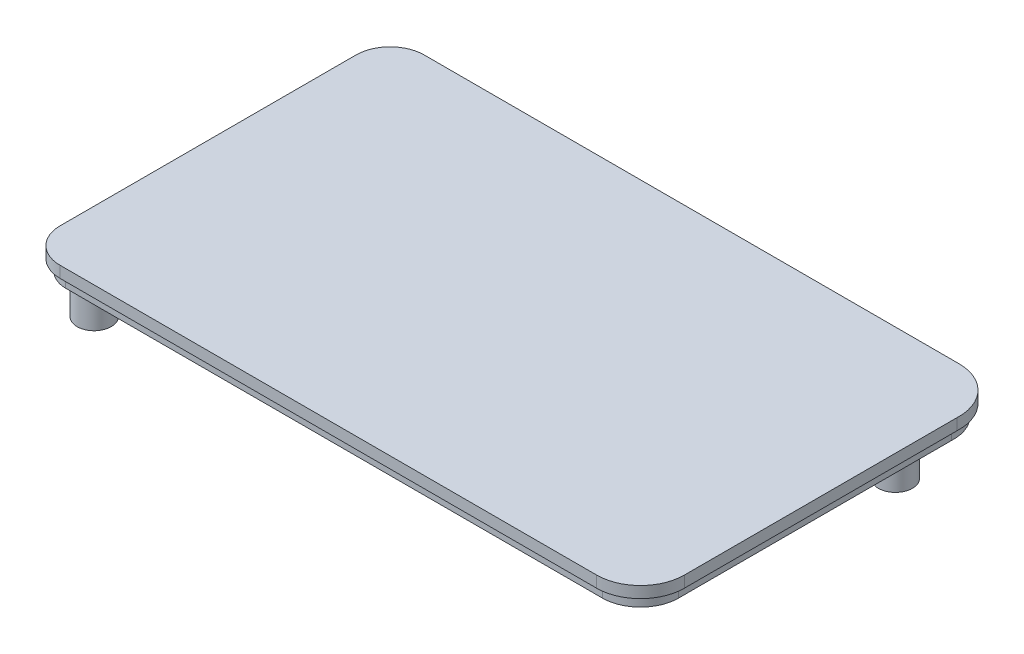
from build123d import *

# Parameters (mm, degrees)
Y_KSEKLIK_EKSTR_ZYON1_DEPTH = 2
KES_EKSTR_ZYON1_DEPTH       = 1
IZIM6_R                     = 1.501031458
IZIM6_R_2                   = 1.001031998
IZIM6_R_3                   = 1.5
IZIM6_R_4                   = 1.00000054
Y_KSEKLIK_EKSTR_ZYON3_DEPTH = 3.425399462


with BuildPart() as part:
    # Çizim1 → Yükseklik-Ekstrüzyon1 (new body)
    with BuildSketch(Plane(origin=(0, 0, 0), x_dir=(1, 0, 0), z_dir=(0, 1, 0))):
        with BuildLine():
            Line((69.354296896, 0), (22.205894341, 0))
            ThreePointArc((22.205894341, 0), (20.084057526, 0.878893586), (19.20516394, 3.000730401))
            Line((19.20516394, 3.000730401), (19.20516394, 28.999269019))
            ThreePointArc((19.20516394, 28.999269019), (20.084057735, 31.121106339), (22.205895054, 32.000000134))
            Line((22.205895054, 32.000000134), (69.204054025, 31.999999983))
            ThreePointArc((69.204054025, 31.999999983), (72.103447224, 30.757719929), (73.203992826, 27.80161776))
            Line((73.203992826, 27.80161776), (73.205163894, 3.84969587))
            ThreePointArc((73.205163894, 3.84969587), (72.076857039, 1.127478795), (69.354296896, 0))
        make_face()
    extrude(amount=Y_KSEKLIK_EKSTR_ZYON1_DEPTH)

    # Çizim2 → Kes-Ekstrüzyon1 (cut)
    with BuildSketch(Plane.XZ):
        with BuildLine():
            Line((22.205894341, 0), (69.354296896, 0))
            ThreePointArc((69.354296896, 0), (72.076886077, -1.127507843), (73.205163905, -3.849778017))
            Line((73.205163905, -3.849778017), (73.204578669, -27.814116173))
            ThreePointArc((73.204578669, -27.814116173), (72.09912832, -30.762246017), (69.204054025, -31.999999983))
            Line((69.204054025, -31.999999983), (22.205895054, -32.000000134))
            ThreePointArc((22.205895054, -32.000000134), (20.084057735, -31.121106339), (19.20516394, -28.999269019))
            Line((19.20516394, -28.999269019), (19.20516394, -3.000730401))
            ThreePointArc((19.20516394, -3.000730401), (20.084057526, -0.878893586), (22.205894341, 0))
        make_face()
        with BuildLine():
            Line((22.205894341, -0.5), (69.354296896, -0.5))
            ThreePointArc((69.354296896, -0.5), (71.723357422, -1.481085951), (72.705163917, -3.849847954))
            Line((72.705163917, -3.849847954), (72.704578383, -27.82580896))
            ThreePointArc((72.704578383, -27.82580896), (71.741441976, -30.412825453), (69.204054025, -31.499999983))
            Line((69.204054025, -31.499999983), (22.205895054, -31.500000134))
            ThreePointArc((22.205895054, -31.500000134), (20.437611125, -30.767552948), (19.70516394, -28.999269019))
            Line((19.70516394, -28.999269019), (19.70516394, -3.000730401))
            ThreePointArc((19.70516394, -3.000730401), (20.437610916, -1.232446977), (22.205894341, -0.5))
        make_face(mode=Mode.SUBTRACT)
    extrude(amount=-KES_EKSTR_ZYON1_DEPTH, mode=Mode.SUBTRACT)

    # Çizim6 → Yükseklik-Ekstrüzyon3 (add)
    # profile 1 of 2: a face of its own
    with BuildSketch(Plane.XZ):
        with Locations(Location((22.205894341, -3.000730401, 0), (0, 0, 90))):
            Circle(IZIM6_R)
        with Locations(Location((22.205894341, -3.000730401, 0), (0, 0, 90))):
            Circle(IZIM6_R_2, mode=Mode.SUBTRACT)
    # profile 2 of 2: a face of its own
    with BuildSketch(Plane.XZ):
        with Locations(Location((69.70516394, -25.900001, 0), (0, 0, 90))):
            Circle(IZIM6_R_3)
        with Locations((69.70516394, -25.900001)):
            Circle(IZIM6_R_4, mode=Mode.SUBTRACT)
    extrude(amount=Y_KSEKLIK_EKSTR_ZYON3_DEPTH)


solid = part.part
